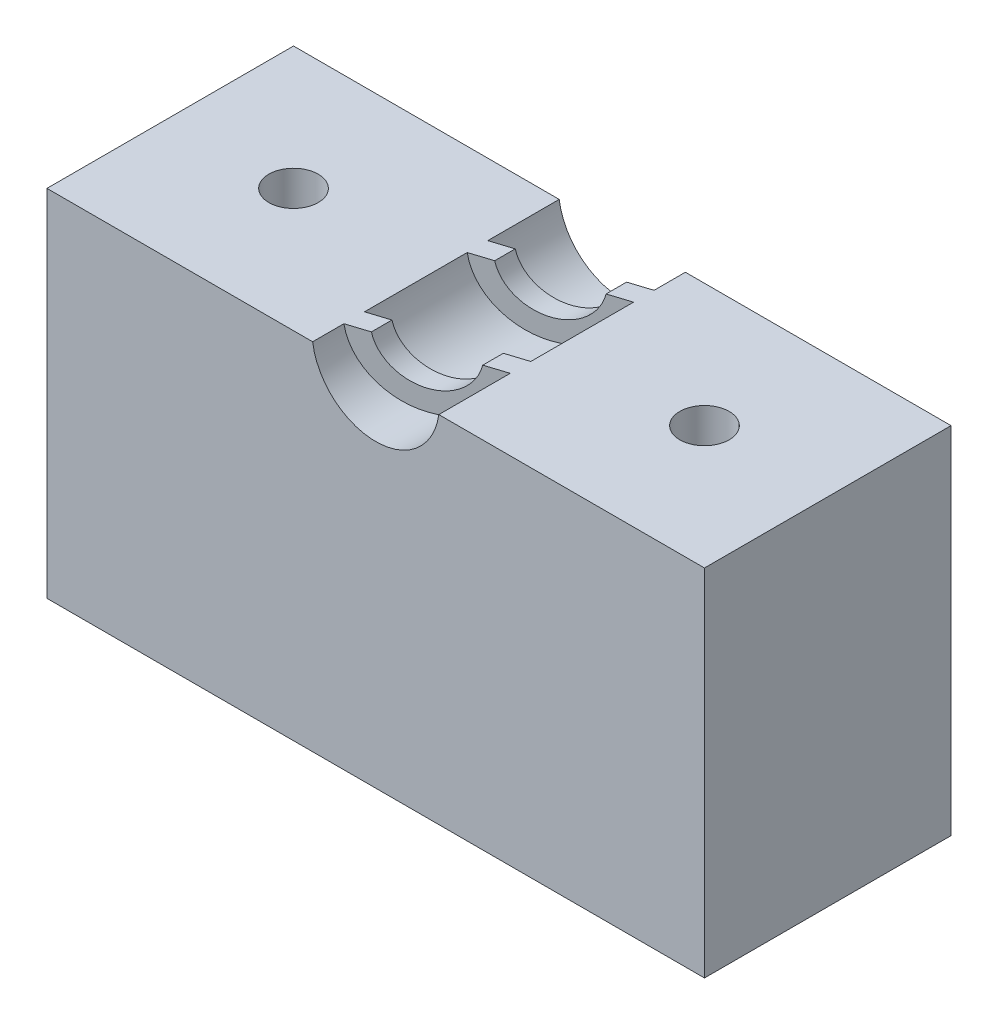
from build123d import *

# Parameters (mm, degrees)
SKETCH_1_W               = 16
SKETCH_1_H               = 16
SKETCH_1_R               = 1.55
EXTRUDE_1_DEPTH          = 3
EXTRUDE_2_DEPTH          = 8
CUT_EXTRUDE_2_DEPTH      = 12.704699911
CUT_EXTRUDE_2_DEPTH_BACK = 12.704699911
SKETCH_8_R               = 0.6
CUT_EXTRUDE_3_DEPTH      = 12.704699911
SKETCH_9_W               = 16
SKETCH_9_H               = 6
SKETCH_9_R               = 0.6
EXTRUDE_3_DEPTH          = 0.855


with BuildPart() as part:
    # 草图1 → 凸台-拉伸1 (new, symmetric)
    with BuildSketch(Plane.XY):
        Rectangle(SKETCH_1_W, SKETCH_1_H)
        Circle(SKETCH_1_R, mode=Mode.SUBTRACT)
    extrude(amount=EXTRUDE_1_DEPTH, both=True)

    # 草图6 → 凸台-拉伸2 (add)
    with BuildSketch(Plane(origin=(0, 0, 0), x_dir=(1, 0, 0), z_dir=(0, 1, 0))):
        Polygon((-1.55, -1.743476048), (-1.55, -2.243476048), (1.55, -1.256523952), (1.55, -0.756523952), align=None)
        Polygon((-1.55, 1.256523952), (-1.55, 0.756523952), (1.55, 1.743476048), (1.55, 2.243476048), align=None)
    extrude(amount=-EXTRUDE_2_DEPTH)

    # 草图7 → 切除-拉伸2 (cut, two sides: drawn at the far end of the back side and taken through both)
    with BuildSketch(Plane.XY.offset(-CUT_EXTRUDE_2_DEPTH_BACK)):
        with BuildLine():
            Line((-8, -0.214092961), (-1.027941732, -0.214092961))
            ThreePointArc((-1.027941732, -0.214092961), (-0.107613153, 1.044470875), (1.05, 0))
            ThreePointArc((1.05, 0), (1.044470875, -0.107613153), (1.027941732, -0.214092961))
            Line((1.027941732, -0.214092961), (8, -0.214092961))
            Line((8, -0.214092961), (8, 8))
            Line((8, 8), (-8, 8))
            Line((-8, 8), (-8, -0.214092961))
        make_face()
        with BuildLine():
            Line((1.027941732, -0.214092961), (0, 0))
            Line((0, 0), (-1.027941732, -0.214092961))
            ThreePointArc((-1.027941732, -0.214092961), (0, -1.05), (1.027941732, -0.214092961))
        make_face()
        with BuildLine():
            Line((-1.027941732, -0.214092961), (0, 0))
            Line((0, 0), (1.027941732, -0.214092961))
            ThreePointArc((1.027941732, -0.214092961), (1.044470875, -0.107613153), (1.05, 0))
            ThreePointArc((1.05, 0), (-0.107613153, 1.044470875), (-1.027941732, -0.214092961))
        make_face()
    extrude(amount=CUT_EXTRUDE_2_DEPTH + CUT_EXTRUDE_2_DEPTH_BACK, mode=Mode.SUBTRACT)

    # 草图8 → 切除-拉伸3 (cut, through all)
    with BuildSketch(Plane(origin=(0, 0, 0), x_dir=(1, 0, 0), z_dir=(0, 1, 0))):
        with Locations(Location((-5, 0, 0), (0, 0, 270))):
            Circle(SKETCH_8_R)
        with Locations(Location((5, 0, 0), (0, 0, 270))):
            Circle(SKETCH_8_R)
    extrude(amount=-CUT_EXTRUDE_3_DEPTH, mode=Mode.SUBTRACT)

    # 草图9 → 凸台-拉伸3 (add)
    with BuildSketch(Plane.XZ.offset(8)):
        Rectangle(SKETCH_9_W, SKETCH_9_H)
        with Locations(Location((-5, 0, 0), (0, 0, 180))):
            Circle(SKETCH_9_R, mode=Mode.SUBTRACT)
        with Locations((5, 0)):
            Circle(SKETCH_9_R, mode=Mode.SUBTRACT)
    extrude(amount=EXTRUDE_3_DEPTH)


solid = part.part
